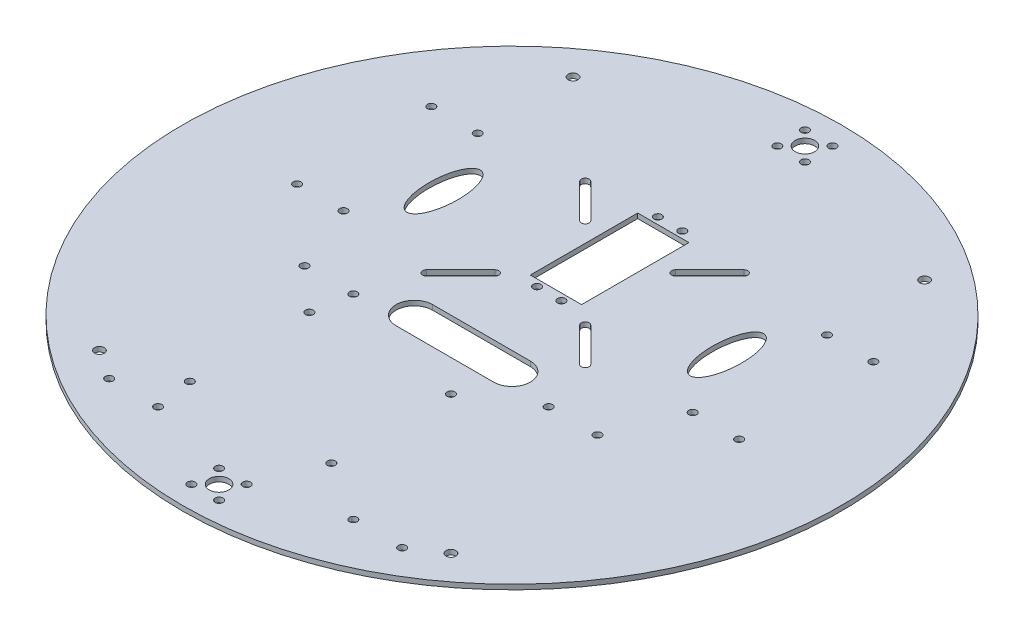
from build123d import *

# Parameters (mm, degrees)
SKETCH_1_R          = 135
EXTRUDE_1_DEPTH     = 2
SKETCH_562_R        = 1.6
SKETCH_562_W        = 21
SKETCH_562_H        = 44
CUT_EXTRUDE_1_DEPTH = 10
SKETCH_1031_R       = 1.6
CUT_EXTRUDE_2_DEPTH = 10
SKETCH_4_R          = 2
SKETCH_4_R_2        = 4
SKETCH_4_R_3        = 1.6
CUT_EXTRUDE_3_DEPTH = 10
CUT_EXTRUDE_4_DEPTH = 10
SKETCH_6_R          = 1.6
SKETCH_6_RX         = 15
SKETCH_6_RY         = 6
CUT_EXTRUDE_7_DEPTH = 10


with BuildPart() as part:
    # 草图1 → 凸台-拉伸1 (new body)
    with BuildSketch(Plane(origin=(0, 0, 0), x_dir=(1, 0, 0), z_dir=(0, 1, 0))):
        with Locations(Location((0, 0, 0), (0, 0, 270))):
            Circle(SKETCH_1_R)
    extrude(amount=EXTRUDE_1_DEPTH)

    # Sketch 562 → 切除-拉伸1 (cut)
    with BuildSketch(Plane(origin=(0, 2, 0), x_dir=(1, 0, 0), z_dir=(0, 1, 0))):
        with Locations(Location((-5, 64.75, 0), (0, 0, 270))):
            Circle(SKETCH_562_R)
        with Locations(Location((5, 64.75, 0), (0, 0, 270))):
            Circle(SKETCH_562_R)
        with Locations(Location((-5, 15.25, 0), (0, 0, 270))):
            Circle(SKETCH_562_R)
        with Locations(Location((5, 15.25, 0), (0, 0, 270))):
            Circle(SKETCH_562_R)
        with Locations(Location((18.5, 48.5, 0), (0, 0, 270))):
            Circle(SKETCH_562_R)
        with Locations(Location((18.5, 11.5, 0), (0, 0, 270))):
            Circle(SKETCH_562_R)
        with Locations(Location((-18.5, 11.5, 0), (0, 0, 270))):
            Circle(SKETCH_562_R)
        with Locations(Location((-18.5, 48.5, 0), (0, 0, 270))):
            Circle(SKETCH_562_R)
        with Locations((0, 40)):
            Rectangle(SKETCH_562_W, SKETCH_562_H)
    extrude(amount=-CUT_EXTRUDE_1_DEPTH, mode=Mode.SUBTRACT)

    # Sketch 1031 → 切除-拉伸2 (cut)
    with BuildSketch(Plane(origin=(0, 2, 0), x_dir=(1, 0, 0), z_dir=(0, 1, 0))):
        with Locations(Location((-60, -25, 0), (0, 0, 270))):
            Circle(SKETCH_1031_R)
        with Locations(Location((-40, -25, 0), (0, 0, 270))):
            Circle(SKETCH_1031_R)
        with Locations(Location((40, -25, 0), (0, 0, 270))):
            Circle(SKETCH_1031_R)
        with Locations(Location((60, -25, 0), (0, 0, 270))):
            Circle(SKETCH_1031_R)
        with Locations(Location((60, -105, 0), (0, 0, 270))):
            Circle(SKETCH_1031_R)
        with Locations(Location((40, -105, 0), (0, 0, 270))):
            Circle(SKETCH_1031_R)
        with Locations(Location((-40, -105, 0), (0, 0, 270))):
            Circle(SKETCH_1031_R)
        with Locations(Location((-60, -105, 0), (0, 0, 270))):
            Circle(SKETCH_1031_R)
        with Locations(Location((-42.5, -89.5, 0), (0, 0, 270))):
            Circle(SKETCH_1031_R)
        with Locations(Location((-42.5, -40.5, 0), (0, 0, 270))):
            Circle(SKETCH_1031_R)
        with Locations(Location((15.5, -40.5, 0), (0, 0, 270))):
            Circle(SKETCH_1031_R)
        with Locations(Location((15.5, -89.5, 0), (0, 0, 270))):
            Circle(SKETCH_1031_R)
    extrude(amount=-CUT_EXTRUDE_2_DEPTH, mode=Mode.SUBTRACT)

    # 草图4 → 切除-拉伸3 (cut)
    with BuildSketch(Plane(origin=(0, 2, 0), x_dir=(1, 0, 0), z_dir=(0, 1, 0))):
        with Locations(Location((-72, 97, 0), (0, 0, 270))):
            Circle(SKETCH_4_R)
        with Locations(Location((72, 97, 0), (0, 0, 270))):
            Circle(SKETCH_4_R)
        with Locations(Location((72, -97, 0), (0, 0, 270))):
            Circle(SKETCH_4_R)
        with Locations(Location((-72, -97, 0), (0, 0, 270))):
            Circle(SKETCH_4_R)
        with Locations(Location((0, -120, 0), (0, 0, 270))):
            Circle(SKETCH_4_R_2)
        with Locations(Location((-5.656854249, -125.656854249, 0), (0, 0, 270))):
            Circle(SKETCH_4_R_3)
        with Locations(Location((-5.656854249, -114.343145751, 0), (0, 0, 270))):
            Circle(SKETCH_4_R_3)
        with Locations(Location((5.656854249, -114.343145751, 0), (0, 0, 270))):
            Circle(SKETCH_4_R_3)
        with Locations(Location((5.656854249, -125.656854249, 0), (0, 0, 270))):
            Circle(SKETCH_4_R_3)
        with Locations(Location((5.656854249, 125.656854249, 0), (0, 0, 270))):
            Circle(SKETCH_4_R_3)
        with Locations(Location((5.656854249, 114.343145751, 0), (0, 0, 270))):
            Circle(SKETCH_4_R_3)
        with Locations(Location((-5.656854249, 114.343145751, 0), (0, 0, 270))):
            Circle(SKETCH_4_R_3)
        with Locations(Location((-5.656854249, 125.656854249, 0), (0, 0, 270))):
            Circle(SKETCH_4_R_3)
        with Locations(Location((0, 120, 0), (0, 0, 270))):
            Circle(SKETCH_4_R_2)
        with BuildLine():
            Line((-20, -12.5), (20, -12.5))
            ThreePointArc((20, -12.5), (27.5, -20), (20, -27.5))
            Line((20, -27.5), (-20, -27.5))
            ThreePointArc((-20, -27.5), (-27.5, -20), (-20, -12.5))
        make_face()
    extrude(amount=-CUT_EXTRUDE_3_DEPTH, mode=Mode.SUBTRACT)

    # 草图5 → 切除-拉伸4 (cut)
    with BuildSketch(Plane(origin=(0, 2, 0), x_dir=(1, 0, 0), z_dir=(0, 1, 0))):
        with BuildLine():
            Line((-31.36862915, 63.63137085), (-17.36862915, 49.63137085))
            ThreePointArc((-17.36862915, 49.63137085), (-17.36862915, 47.36862915), (-19.63137085, 47.36862915))
            Line((-19.63137085, 47.36862915), (-33.63137085, 61.36862915))
            ThreePointArc((-33.63137085, 61.36862915), (-33.63137085, 63.63137085), (-31.36862915, 63.63137085))
        make_face()
        with BuildLine():
            Line((33.63137085, 61.36862915), (19.63137085, 47.36862915))
            ThreePointArc((19.63137085, 47.36862915), (17.36862915, 47.36862915), (17.36862915, 49.63137085))
            Line((17.36862915, 49.63137085), (31.36862915, 63.63137085))
            ThreePointArc((31.36862915, 63.63137085), (33.63137085, 63.63137085), (33.63137085, 61.36862915))
        make_face()
        with BuildLine():
            Line((31.36862915, -3.63137085), (17.36862915, 10.36862915))
            ThreePointArc((17.36862915, 10.36862915), (17.36862915, 12.63137085), (19.63137085, 12.63137085))
            Line((19.63137085, 12.63137085), (33.63137085, -1.36862915))
            ThreePointArc((33.63137085, -1.36862915), (33.63137085, -3.63137085), (31.36862915, -3.63137085))
        make_face()
        with BuildLine():
            Line((-33.63137085, -1.36862915), (-19.63137085, 12.63137085))
            ThreePointArc((-19.63137085, 12.63137085), (-17.36862915, 12.63137085), (-17.36862915, 10.36862915))
            Line((-17.36862915, 10.36862915), (-31.36862915, -3.63137085))
            ThreePointArc((-31.36862915, -3.63137085), (-33.63137085, -3.63137085), (-33.63137085, -1.36862915))
        make_face()
    extrude(amount=-CUT_EXTRUDE_4_DEPTH, mode=Mode.SUBTRACT)

    # 草图6 → 切除-拉伸7 (cut)
    with BuildSketch(Plane(origin=(0, 2, 0), x_dir=(1, 0, 0), z_dir=(0, 1, 0))):
        with Locations(Location((71.537199543, 2.5, 0), (0, 0, 270))):
            Circle(SKETCH_6_R)
        with Locations(Location((90.537199543, 2.5, 0), (0, 0, 270))):
            Circle(SKETCH_6_R)
        with Locations(Location((90.537199543, 57.5, 0), (0, 0, 270))):
            Circle(SKETCH_6_R)
        with Locations(Location((71.537199543, 57.5, 0), (0, 0, 270))):
            Circle(SKETCH_6_R)
        with Locations(Location((-71.537199543, 57.5, 0), (0, 0, 270))):
            Circle(SKETCH_6_R)
        with Locations(Location((-90.537199543, 2.5, 0), (0, 0, 270))):
            Circle(SKETCH_6_R)
        with Locations(Location((-71.537199543, 2.5, 0), (0, 0, 270))):
            Circle(SKETCH_6_R)
        with Locations(Location((-90.537199543, 57.5, 0), (0, 0, 270))):
            Circle(SKETCH_6_R)
        with Locations(Location((-58.031053316, 30), (0, 0, -90))):
            Ellipse(SKETCH_6_RX, SKETCH_6_RY)
        with Locations(Location((58.031053316, 30), (0, 0, 90))):
            Ellipse(SKETCH_6_RX, SKETCH_6_RY)
    extrude(amount=-CUT_EXTRUDE_7_DEPTH, mode=Mode.SUBTRACT)


solid = part.part
